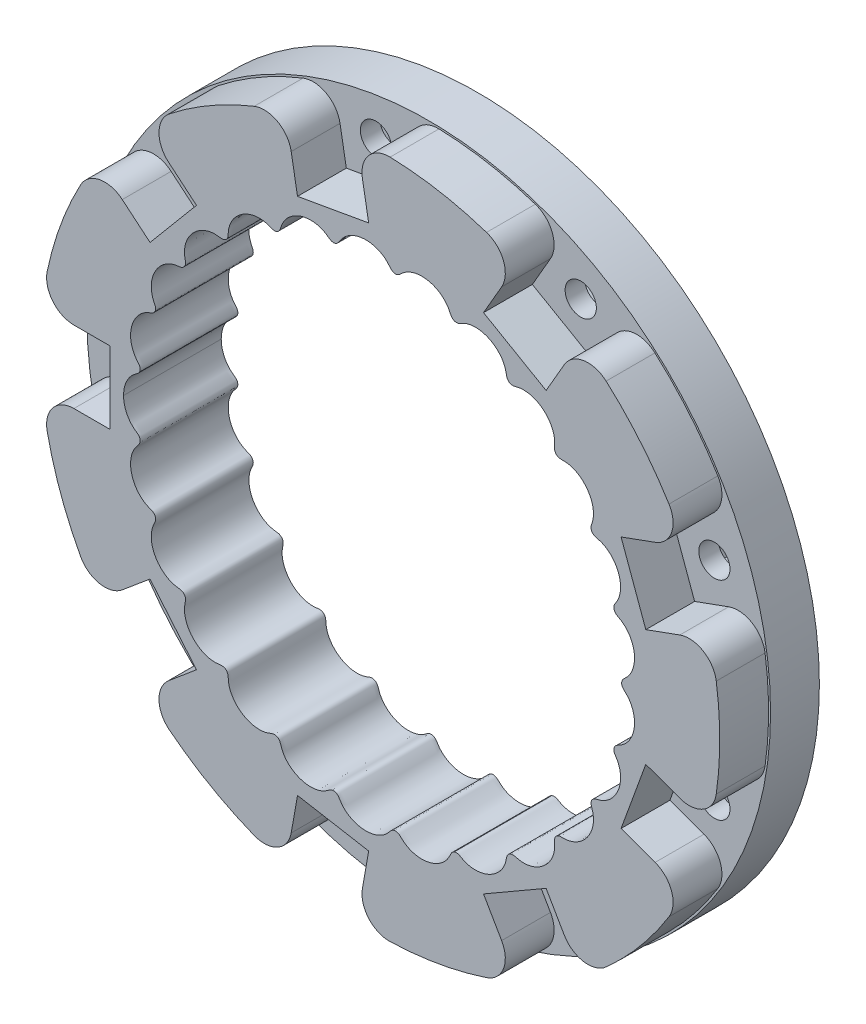
from build123d import *

# Parameters (mm, degrees)
ESQUISSE1_R             = 35
BOSS_EXTRU_1_DEPTH      = 10
ESQUISSE2_R             = 44.703039179
ENL_V_MAT_EXTRU_3_DEPTH = 5
ESQUISSE4_R             = 1.6
ENL_V_MAT_EXTRU_5_DEPTH = 50.749372006
ENL_V_MAT_EXTRU_4_DEPTH = 3


with BuildPart() as part:
    # Esquisse1 → Boss.-Extru.1 (new body)
    with BuildSketch(Plane.XY):
        Circle(ESQUISSE1_R)
        with BuildLine():
            add(Edge.make_bspline(
                [(24.75, 0), (24.75, -0.01190895), (24.750668659, -0.029768799), (24.75289752, -0.060006713), (24.758884934, -0.104774168), (24.767485304, -0.1467503), (24.785152354, -0.206071411), (24.818482478, -0.284185867), (24.880818803, -0.385919884), (24.984658612, -0.50047292), (25.114781066, -0.616600782), (25.255435339, -0.752464933), (25.419807145, -0.93333087), (25.594989864, -1.169106201), (25.768920192, -1.472936072), (25.920736133, -1.849650866), (26.023477253, -2.249860974), (26.074696747, -2.666946621), (26.073312156, -3.086313852), (26.020370658, -3.501501101), (25.917002683, -3.906273732), (25.764403676, -4.294347485), (25.566224565, -4.654785317), (25.325903213, -4.981499954), (25.081588671, -5.233067427), (24.851914535, -5.418631885), (24.667098284, -5.540217829), (24.539548747, -5.613941762), (24.410179088, -5.684594723), (24.273991814, -5.758046627), (24.120002912, -5.867762768), (23.989867, -6.050335584), (23.936355638, -6.275127193), (23.969192195, -6.495758333), (24.065351302, -6.684284012), (24.178449314, -6.851934675), (24.280144364, -7.019011908), (24.393570042, -7.235347013), (24.503436737, -7.50770452), (24.595094748, -7.84543671), (24.647032867, -8.248159789), (24.645694803, -8.661209862), (24.57595365, -9.185528563), (24.417645445, -9.696077248), (24.174741138, -10.176578568), (23.852030812, -10.610062282), (23.558837347, -10.90980476), (23.24095056, -11.157802847), (22.946586259, -11.329086722), (22.692113519, -11.440823192), (22.472657763, -11.513539342), (22.29388462, -11.561503733), (22.101259895, -11.606028638), (21.902055354, -11.681610724), (21.728453668, -11.828148656), (21.620885016, -12.038837081), (21.601595838, -12.263660858), (21.650481834, -12.469316746), (21.718254479, -12.659791435), (21.774584138, -12.84705718), (21.829677768, -13.084963879), (21.867201208, -13.376160202), (21.870688906, -13.725995236), (21.819474916, -14.128698884), (21.71419458, -14.527993453), (21.514773646, -15.017801417), (21.233133123, -15.4720736), (20.877140734, -15.876030958), (20.455657215, -16.214386724), (20.096354081, -16.430676116), (19.726170583, -16.590569736), (19.398076252, -16.68206281), (19.123633935, -16.725922166), (18.892914818, -16.74091163), (18.707848134, -16.742350192), (18.510091067, -16.737829569), (18.298399992, -16.764443666), (18.095471353, -16.866909122), (17.942147178, -17.047179332), (17.871387572, -17.261366287), (17.870202468, -17.472525416), (17.888313355, -17.673814374), (17.895669209, -17.869207586), (17.888886536, -18.113260777), (17.85168272, -18.404436203), (17.766823301, -18.743754438), (17.615819616, -19.120463832), (17.413434594, -19.48028858), (17.162321288, -19.816819375), (16.868500143, -20.122110223), (16.535786091, -20.390797243), (16.168397966, -20.617282366), (15.771042449, -20.795687849), (15.368766607, -20.914546396), (14.97017149, -20.975982916), (14.629556137, -20.981746846), (14.352921577, -20.954877105), (14.125857036, -20.911170138), (13.94640051, -20.866001244), (13.755772511, -20.812781493), (13.543469889, -20.788894817), (13.322238716, -20.84166807), (13.131407642, -20.981742865), (13.0130413, -21.173627181), (12.961818542, -21.378246364), (12.929064797, -21.57761534), (12.886990745, -21.768547341), (12.818791692, -22.002934942), (12.70930802, -22.275243379), (12.541628211, -22.582120244), (12.300626204, -22.908551746), (12.01422203, -23.205749325), (11.686582401, -23.4681837), (11.325453487, -23.689705246), (10.935854532, -23.866053147), (10.523258626, -23.992837457), (10.093696991, -24.06550579), (9.674368845, -24.079231972), (9.273085465, -24.038208914), (8.941983123, -23.957846351), (8.681067639, -23.861969077), (8.472360468, -23.762392874), (8.310008249, -23.673519219), (8.138322101, -23.574972467), (7.937182673, -23.501849574), (7.704899941, -23.502076627), (7.478095746, -23.600741865), (7.316947907, -23.77285878), (7.220831609, -23.97055906), (7.115634845, -24.203403783), (6.974300377, -24.460401189), (6.773045478, -24.737487424), (6.497851462, -25.02237666), (6.183428844, -25.270910892), (5.835740341, -25.479668636), (5.460328709, -25.645214949), (5.061542815, -25.765601822), (4.644666369, -25.83709061), (4.215744672, -25.855893135), (3.781608585, -25.818103671), (3.372294549, -25.725760832), (2.994169108, -25.584908149), (2.694109042, -25.423555897), (2.465647641, -25.264915254), (2.289085947, -25.115815571), (2.153739497, -24.989104422), (2.012318186, -24.851122457), (1.832423714, -24.733108156), (1.552983355, -24.66593755), (1.26214529, -24.754622086), (1.075414287, -24.957557798), (0.889090341, -25.194134228), (0.69672049, -25.401829912), (0.44758856, -25.61527269), (0.125683965, -25.821812182), (-0.224585626, -25.987068298), (-0.598975616, -26.109092558), (-0.990876156, -26.185347308), (-1.391941275, -26.2145582), (-1.796224618, -26.195837186), (-2.198144681, -26.128499562), (-2.591457519, -26.011923113), (-2.962803429, -25.848997421), (-3.306221845, -25.642423994), (-3.61537583, -25.39483403), (-3.850272783, -25.145621471), (-4.023133112, -24.908691884), (-4.156981332, -24.691054937), (-4.276293257, -24.506578487), (-4.456318725, -24.354528199), (-4.693068775, -24.282897531), (-4.923798246, -24.309710303), (-5.115035952, -24.406102337), (-5.273240645, -24.525178417), (-5.42301226, -24.633920894), (-5.617383402, -24.75923363), (-5.863981708, -24.887558689), (-6.182207181, -25.009385657), (-6.575059912, -25.101071531), (-6.9927825, -25.140689035), (-7.428136381, -25.123106217), (-7.851204623, -25.050059218), (-8.255644199, -24.926289526), (-8.635975215, -24.756290763), (-8.987390026, -24.544434268), (-9.305810055, -24.293211507), (-9.586131065, -24.006734367), (-9.822904508, -23.689158592), (-9.987239236, -23.388704672), (-10.094751199, -23.11580793), (-10.169610451, -22.871508954), (-10.24112571, -22.663502872), (-10.381175345, -22.473662137), (-10.594956363, -22.349311543), (-10.825624608, -22.322047042), (-11.033849204, -22.370890621), (-11.216381876, -22.447371753), (-11.388695767, -22.514940651), (-11.608352834, -22.58716666), (-11.87933894, -22.649041617), (-12.217942215, -22.68664221), (-12.621151131, -22.6763477), (-13.035301253, -22.609509201), (-13.452127793, -22.482943679), (-13.845292771, -22.304868342), (-14.20938889, -22.080540487), (-14.539531306, -21.814993299), (-14.831269767, -21.513076759), (-15.077661765, -21.181891436), (-15.275270226, -20.827454377), (-15.402577207, -20.501715906), (-15.476526159, -20.217667398), (-15.514326563, -19.976485954), (-15.531829272, -19.781749163), (-15.539202372, -19.579813227), (-15.565591069, -19.370421028), (-15.660806856, -19.1659885), (-15.83405536, -19.004717982), (-16.047591105, -18.926560558), (-16.261088064, -18.925182163), (-16.456798489, -18.954287053), (-16.640543184, -18.976331541), (-16.871307425, -18.990807395), (-17.149104778, -18.982241272), (-17.486194881, -18.933211709), (-17.873723074, -18.821638459), (-18.257615968, -18.652692803), (-18.629084532, -18.425342732), (-18.964764813, -18.15411038), (-19.260725449, -17.845401443), (-19.513475385, -17.50529118), (-19.719894943, -17.139574851), (-19.874988153, -16.756923442), (-19.976929286, -16.364037242), (-20.017953734, -16.016642642), (-20.017798024, -15.723070973), (-19.993447495, -15.480115157), (-19.96134753, -15.287225434), (-19.918054975, -15.089779832), (-19.89402871, -14.879875268), (-19.939362883, -14.658860507), (-20.070693635, -14.462043286), (-20.260249499, -14.336679591), (-20.467155514, -14.285214031), (-20.663881817, -14.2650629), (-20.847282484, -14.240161779), (-21.074211831, -14.195950386), (-21.340836688, -14.11751373), (-21.654611423, -13.985047804), (-22.001454707, -13.779432555), (-22.330360371, -13.519308084), (-22.705485211, -13.130240844), (-23.007369545, -12.684411231), (-23.229136266, -12.198075036), (-23.364819327, -11.686883469), (-23.418570267, -11.277399868), (-23.418213213, -10.871399708), (-23.370257339, -10.524800668), (-23.295965049, -10.240716159), (-23.211017087, -10.011726748), (-23.131365089, -9.833119484), (-23.040198426, -9.652618084), (-22.96715924, -9.454144986), (-22.960141523, -9.228680333), (-23.042373084, -9.007208297), (-23.198166311, -8.840665724), (-23.388940312, -8.741382585), (-23.57769294, -8.6722803), (-23.75308195, -8.599853942), (-23.966244513, -8.496298837), (-24.209343816, -8.347711506), (-24.48032477, -8.1355972), (-24.761295108, -7.846344695), (-25.008480075, -7.513349868), (-25.26655565, -7.04900195), (-25.442920247, -6.54763643), (-25.533949151, -6.025561479), (-25.536599067, -5.498854498), (-25.485486947, -5.088916426), (-25.382794666, -4.696000106), (-25.248906316, -4.372612425), (-25.105242941, -4.116427211), (-24.965170858, -3.916248887), (-24.843083512, -3.763442502), (-24.709834093, -3.611215538), (-24.591948067, -3.435387495), (-24.533798882, -3.220620895), (-24.560423715, -2.992589013), (-24.66665443, -2.797016304), (-24.822727104, -2.653701408), (-24.98966356, -2.53926073), (-25.146322188, -2.422077132), (-25.332496393, -2.263776399), (-25.502275925, -2.087254142), (-25.654526877, -1.895838833), (-25.79052351, -1.688263992), (-25.890012472, -1.511998867), (-25.978955887, -1.325507929), (-26.056614781, -1.131467198), (-26.121383307, -0.930707527), (-26.173241314, -0.729759288), (-26.207287779, -0.545661218), (-26.228372118, -0.39585777), (-26.240536879, -0.255725402), (-26.247025958, -0.16909655), (-26.249459241, -0.066739393), (-26.25, -0.022255367), (-26.25, 0)],
                knots=[0.07432085, 0.07432085, 0.07432085, 0.07432085, 0.07432085, 0.074838236, 0.075096929, 0.075355622, 0.075873009, 0.076390395, 0.077425167, 0.07845994, 0.080262761, 0.082065582, 0.083868403, 0.085671224, 0.089276866, 0.092882508, 0.096749545, 0.100616583, 0.104483621, 0.108350658, 0.112188336, 0.116026013, 0.11986369, 0.123701367, 0.12732655, 0.130951733, 0.132764324, 0.134576916, 0.135483211, 0.136389507, 0.138202099, 0.140295775, 0.142389451, 0.144458848, 0.146528245, 0.148330503, 0.150132762, 0.15193502, 0.153737278, 0.157341795, 0.160946311, 0.164812321, 0.16867833, 0.17254434, 0.180415799, 0.184421248, 0.188426697, 0.192432147, 0.195844027, 0.199255907, 0.200961848, 0.202667788, 0.204373728, 0.206079668, 0.208268892, 0.210458115, 0.21252702, 0.214595925, 0.216397713, 0.218199501, 0.220001289, 0.221803077, 0.225406654, 0.22901023, 0.232875219, 0.236740209, 0.240605199, 0.248476586, 0.252482983, 0.25648938, 0.260495777, 0.263907756, 0.267319735, 0.269025725, 0.270731714, 0.272437704, 0.274143693, 0.276335152, 0.278526612, 0.280594702, 0.282662792, 0.284464203, 0.286265613, 0.288067024, 0.289868435, 0.293471257, 0.297074079, 0.300938067, 0.304802055, 0.308666044, 0.312530032, 0.316537343, 0.320544653, 0.324551964, 0.328559274, 0.331971493, 0.335383713, 0.337089822, 0.338795932, 0.340502041, 0.342208151, 0.3444015, 0.346594848, 0.348661829, 0.35072881, 0.352529935, 0.354331061, 0.356132186, 0.357933311, 0.361535562, 0.365137813, 0.369000829, 0.372863844, 0.37672686, 0.380589876, 0.384598055, 0.388606234, 0.392614413, 0.396622592, 0.400035189, 0.403447785, 0.405154083, 0.406860381, 0.408566679, 0.410272977, 0.412467856, 0.414662735, 0.416905332, 0.41914793, 0.420947533, 0.422747136, 0.426346341, 0.429945547, 0.433544752, 0.437320979, 0.441097206, 0.444873433, 0.44864966, 0.452658654, 0.456667648, 0.460676642, 0.464685636, 0.468098738, 0.471511839, 0.473218389, 0.47492494, 0.476631491, 0.478338041, 0.480534086, 0.48273013, 0.487019518, 0.488748834, 0.49047815, 0.493936782, 0.497395414, 0.500854047, 0.504530334, 0.508206621, 0.511882908, 0.515559195, 0.519334982, 0.52311077, 0.526886557, 0.530662345, 0.534261527, 0.537860709, 0.541459892, 0.543259483, 0.545059074, 0.547300663, 0.549542252, 0.55173776, 0.553933267, 0.555639684, 0.5573461, 0.559052517, 0.560758933, 0.564171767, 0.5675846, 0.571593194, 0.575601788, 0.579610382, 0.583618976, 0.587395654, 0.591172332, 0.594949011, 0.598725689, 0.602324954, 0.605924219, 0.609523484, 0.611323117, 0.613122749, 0.615366313, 0.617609877, 0.619804036, 0.621998195, 0.623704391, 0.625410586, 0.627116782, 0.628822977, 0.632235368, 0.635647759, 0.63965551, 0.643663261, 0.647671012, 0.651678763, 0.655542261, 0.659405759, 0.663269257, 0.667132755, 0.670735268, 0.674337782, 0.676139039, 0.677940295, 0.679741552, 0.681542809, 0.683610379, 0.685677949, 0.687870397, 0.690062845, 0.691768886, 0.693474927, 0.695180968, 0.696887009, 0.700299091, 0.703711172, 0.707718031, 0.71172489, 0.715731748, 0.719738607, 0.723603093, 0.727467579, 0.731332066, 0.735196552, 0.738799727, 0.742402903, 0.744204491, 0.746006079, 0.747807667, 0.749609255, 0.751677791, 0.753746327, 0.755936711, 0.758127095, 0.75983305, 0.761539006, 0.763244962, 0.764950918, 0.76836283, 0.771774741, 0.775780668, 0.779786595, 0.783792522, 0.791663947, 0.795529445, 0.799394943, 0.803260441, 0.806864464, 0.810468487, 0.812270499, 0.81407251, 0.815874522, 0.817676533, 0.819745726, 0.821814919, 0.823998833, 0.826182748, 0.827931402, 0.829680057, 0.831428712, 0.833177366, 0.836674676, 0.840171985, 0.844093542, 0.8480151, 0.851936657, 0.859724738, 0.863591261, 0.867457784, 0.871324307, 0.874929364, 0.87853442, 0.880336948, 0.882139476, 0.883942004, 0.885744532, 0.887814048, 0.889883563, 0.891953048, 0.894022532, 0.895825669, 0.897628805, 0.899431941, 0.901235078, 0.90484135, 0.906644487, 0.908447623, 0.910381399, 0.912315175, 0.914248951, 0.916182727, 0.918116503, 0.920050278, 0.921017166, 0.921984054, 0.922950942, 0.92391783, 0.92391783, 0.92391783, 0.92391783, 0.92391783], degree=4))
            add(Edge.make_bspline(
                [(24.75, 0), (24.75, 0.01190895), (24.750668659, 0.029768799), (24.75289752, 0.060006713), (24.758884934, 0.104774168), (24.767485304, 0.1467503), (24.785152354, 0.206071411), (24.818482478, 0.284185867), (24.880818803, 0.385919884), (24.984658612, 0.50047292), (25.114781066, 0.616600782), (25.255435339, 0.752464933), (25.419807145, 0.93333087), (25.594989864, 1.169106201), (25.768920192, 1.472936072), (25.920736133, 1.849650866), (26.023477253, 2.249860974), (26.074696747, 2.666946621), (26.073312156, 3.086313852), (26.020370658, 3.501501101), (25.917002683, 3.906273732), (25.764403676, 4.294347485), (25.566224565, 4.654785317), (25.325903213, 4.981499954), (25.081588671, 5.233067427), (24.851914535, 5.418631885), (24.667098284, 5.540217829), (24.539548747, 5.613941762), (24.410179088, 5.684594723), (24.273991814, 5.758046627), (24.120002912, 5.867762768), (23.989867, 6.050335584), (23.936355638, 6.275127193), (23.969192195, 6.495758333), (24.065351302, 6.684284012), (24.178449314, 6.851934675), (24.280144364, 7.019011908), (24.393570042, 7.235347013), (24.503436737, 7.50770452), (24.595094748, 7.84543671), (24.647032867, 8.248159789), (24.645694803, 8.661209862), (24.57595365, 9.185528563), (24.417645445, 9.696077248), (24.174741138, 10.176578568), (23.852030812, 10.610062282), (23.558837347, 10.90980476), (23.24095056, 11.157802847), (22.946586259, 11.329086722), (22.692113519, 11.440823192), (22.472657763, 11.513539342), (22.29388462, 11.561503733), (22.101259895, 11.606028638), (21.902055354, 11.681610724), (21.728453668, 11.828148656), (21.620885016, 12.038837081), (21.601595838, 12.263660858), (21.650481834, 12.469316746), (21.718254479, 12.659791435), (21.774584138, 12.84705718), (21.829677768, 13.084963879), (21.867201208, 13.376160202), (21.870688906, 13.725995236), (21.819474916, 14.128698884), (21.71419458, 14.527993453), (21.514773646, 15.017801417), (21.233133123, 15.4720736), (20.877140734, 15.876030958), (20.455657215, 16.214386724), (20.096354081, 16.430676116), (19.726170583, 16.590569736), (19.398076252, 16.68206281), (19.123633935, 16.725922166), (18.892914818, 16.74091163), (18.707848134, 16.742350192), (18.510091067, 16.737829569), (18.298399992, 16.764443666), (18.095471353, 16.866909122), (17.942147178, 17.047179332), (17.871387572, 17.261366287), (17.870202468, 17.472525416), (17.888313355, 17.673814374), (17.895669209, 17.869207586), (17.888886536, 18.113260777), (17.85168272, 18.404436203), (17.766823301, 18.743754438), (17.615819616, 19.120463832), (17.413434594, 19.48028858), (17.162321288, 19.816819375), (16.868500143, 20.122110223), (16.535786091, 20.390797243), (16.168397966, 20.617282366), (15.771042449, 20.795687849), (15.368766607, 20.914546396), (14.97017149, 20.975982916), (14.629556137, 20.981746846), (14.352921577, 20.954877105), (14.125857036, 20.911170138), (13.94640051, 20.866001244), (13.755772511, 20.812781493), (13.543469889, 20.788894817), (13.322238716, 20.84166807), (13.131407642, 20.981742865), (13.0130413, 21.173627181), (12.961818542, 21.378246364), (12.929064797, 21.57761534), (12.886990745, 21.768547341), (12.818791692, 22.002934942), (12.70930802, 22.275243379), (12.541628211, 22.582120244), (12.300626204, 22.908551746), (12.01422203, 23.205749325), (11.686582401, 23.4681837), (11.325453487, 23.689705246), (10.935854532, 23.866053147), (10.523258626, 23.992837457), (10.093696991, 24.06550579), (9.674368845, 24.079231972), (9.273085465, 24.038208914), (8.941983123, 23.957846351), (8.681067639, 23.861969077), (8.472360468, 23.762392874), (8.310008249, 23.673519219), (8.138322101, 23.574972467), (7.937182673, 23.501849574), (7.704899941, 23.502076627), (7.478095746, 23.600741865), (7.316947907, 23.772858779), (7.220831609, 23.97055906), (7.115634845, 24.203403783), (6.974300377, 24.460401189), (6.773045477, 24.737487424), (6.497851462, 25.02237666), (6.183428844, 25.270910892), (5.835740341, 25.479668636), (5.460328709, 25.645214949), (5.061542815, 25.765601822), (4.644666369, 25.83709061), (4.215744672, 25.855893135), (3.781608585, 25.818103671), (3.372294549, 25.725760832), (2.994169108, 25.584908149), (2.694109042, 25.423555897), (2.465647641, 25.264915254), (2.289085947, 25.115815571), (2.153739497, 24.989104422), (2.012318186, 24.851122457), (1.832423714, 24.733108156), (1.552983354, 24.66593755), (1.26214529, 24.754622086), (1.075414287, 24.957557798), (0.889090341, 25.194134228), (0.69672049, 25.401829912), (0.44758856, 25.61527269), (0.125683965, 25.821812182), (-0.224585626, 25.987068298), (-0.598975616, 26.109092558), (-0.990876156, 26.185347308), (-1.391941275, 26.2145582), (-1.796224618, 26.195837186), (-2.198144681, 26.128499562), (-2.591457519, 26.011923113), (-2.962803429, 25.848997421), (-3.306221845, 25.642423994), (-3.61537583, 25.39483403), (-3.850272783, 25.145621471), (-4.023133112, 24.908691884), (-4.156981332, 24.691054937), (-4.276293257, 24.506578487), (-4.456318725, 24.354528199), (-4.693068775, 24.282897531), (-4.923798246, 24.309710303), (-5.115035952, 24.406102337), (-5.273240646, 24.525178417), (-5.42301226, 24.633920894), (-5.617383402, 24.75923363), (-5.863981708, 24.887558689), (-6.182207181, 25.009385657), (-6.575059912, 25.101071531), (-6.9927825, 25.140689035), (-7.428136381, 25.123106217), (-7.851204623, 25.050059218), (-8.255644199, 24.926289526), (-8.635975215, 24.756290763), (-8.987390026, 24.544434268), (-9.305810055, 24.293211507), (-9.586131065, 24.006734367), (-9.822904508, 23.689158592), (-9.987239236, 23.388704672), (-10.094751199, 23.11580793), (-10.169610451, 22.871508954), (-10.24112571, 22.663502872), (-10.381175345, 22.473662137), (-10.594956363, 22.349311543), (-10.825624608, 22.322047042), (-11.033849204, 22.370890621), (-11.216381876, 22.447371753), (-11.388695767, 22.514940651), (-11.608352834, 22.58716666), (-11.87933894, 22.649041617), (-12.217942215, 22.68664221), (-12.621151131, 22.676347699), (-13.035301253, 22.609509201), (-13.452127793, 22.482943679), (-13.845292771, 22.304868342), (-14.20938889, 22.080540487), (-14.539531306, 21.814993299), (-14.831269767, 21.513076759), (-15.077661765, 21.181891436), (-15.275270226, 20.827454377), (-15.402577207, 20.501715906), (-15.476526159, 20.217667398), (-15.514326563, 19.976485954), (-15.531829272, 19.781749163), (-15.539202372, 19.579813227), (-15.565591069, 19.370421028), (-15.660806856, 19.1659885), (-15.83405536, 19.004717982), (-16.047591105, 18.926560558), (-16.261088064, 18.925182163), (-16.456798489, 18.954287053), (-16.640543184, 18.976331541), (-16.871307425, 18.990807395), (-17.149104778, 18.982241272), (-17.486194881, 18.933211709), (-17.873723074, 18.821638459), (-18.257615968, 18.652692802), (-18.629084532, 18.425342732), (-18.964764813, 18.15411038), (-19.260725449, 17.845401443), (-19.513475385, 17.50529118), (-19.719894943, 17.139574851), (-19.874988153, 16.756923442), (-19.976929286, 16.364037242), (-20.017953734, 16.016642642), (-20.017798024, 15.723070973), (-19.993447495, 15.480115157), (-19.96134753, 15.287225434), (-19.918054975, 15.089779832), (-19.89402871, 14.879875268), (-19.939362883, 14.658860507), (-20.070693635, 14.462043286), (-20.260249499, 14.336679591), (-20.467155514, 14.285214031), (-20.663881817, 14.2650629), (-20.847282484, 14.240161779), (-21.074211831, 14.195950386), (-21.340836688, 14.11751373), (-21.654611423, 13.985047804), (-22.001454707, 13.779432555), (-22.330360371, 13.519308084), (-22.705485211, 13.130240844), (-23.007369545, 12.684411231), (-23.229136266, 12.198075036), (-23.364819327, 11.686883469), (-23.418570267, 11.277399868), (-23.418213213, 10.871399708), (-23.370257339, 10.524800667), (-23.295965049, 10.240716159), (-23.211017087, 10.011726748), (-23.131365089, 9.833119484), (-23.040198426, 9.652618084), (-22.96715924, 9.454144986), (-22.960141523, 9.228680333), (-23.042373084, 9.007208297), (-23.198166311, 8.840665724), (-23.388940312, 8.741382585), (-23.57769294, 8.6722803), (-23.75308195, 8.599853942), (-23.966244513, 8.496298837), (-24.209343816, 8.347711506), (-24.48032477, 8.1355972), (-24.761295108, 7.846344695), (-25.008480075, 7.513349868), (-25.26655565, 7.04900195), (-25.442920247, 6.54763643), (-25.533949151, 6.025561479), (-25.536599067, 5.498854498), (-25.485486947, 5.088916426), (-25.382794666, 4.696000106), (-25.248906316, 4.372612425), (-25.105242941, 4.116427211), (-24.965170858, 3.916248887), (-24.843083512, 3.763442502), (-24.709834093, 3.611215538), (-24.591948067, 3.435387495), (-24.533798882, 3.220620895), (-24.560423715, 2.992589013), (-24.66665443, 2.797016303), (-24.822727104, 2.653701408), (-24.98966356, 2.53926073), (-25.146322188, 2.422077132), (-25.332496393, 2.263776399), (-25.502275925, 2.087254142), (-25.654526877, 1.895838833), (-25.79052351, 1.688263992), (-25.890012472, 1.511998867), (-25.978955887, 1.325507929), (-26.056614781, 1.131467198), (-26.121383307, 0.930707527), (-26.173241314, 0.729759288), (-26.207287779, 0.545661218), (-26.228372118, 0.39585777), (-26.240536879, 0.255725402), (-26.247025958, 0.16909655), (-26.249459241, 0.066739393), (-26.25, 0.022255367), (-26.25, 0)],
                knots=[0.07432085, 0.07432085, 0.07432085, 0.07432085, 0.07432085, 0.074838236, 0.075096929, 0.075355622, 0.075873009, 0.076390395, 0.077425167, 0.07845994, 0.080262761, 0.082065582, 0.083868403, 0.085671224, 0.089276866, 0.092882508, 0.096749545, 0.100616583, 0.104483621, 0.108350658, 0.112188336, 0.116026013, 0.11986369, 0.123701367, 0.12732655, 0.130951733, 0.132764324, 0.134576916, 0.135483211, 0.136389507, 0.138202099, 0.140295775, 0.142389451, 0.144458848, 0.146528245, 0.148330503, 0.150132762, 0.15193502, 0.153737278, 0.157341795, 0.160946311, 0.164812321, 0.16867833, 0.17254434, 0.180415799, 0.184421248, 0.188426697, 0.192432147, 0.195844027, 0.199255907, 0.200961848, 0.202667788, 0.204373728, 0.206079668, 0.208268892, 0.210458115, 0.21252702, 0.214595925, 0.216397713, 0.218199501, 0.220001289, 0.221803077, 0.225406654, 0.22901023, 0.232875219, 0.236740209, 0.240605199, 0.248476586, 0.252482983, 0.25648938, 0.260495777, 0.263907756, 0.267319735, 0.269025725, 0.270731714, 0.272437704, 0.274143693, 0.276335152, 0.278526612, 0.280594702, 0.282662792, 0.284464203, 0.286265613, 0.288067024, 0.289868435, 0.293471257, 0.297074079, 0.300938067, 0.304802055, 0.308666044, 0.312530032, 0.316537343, 0.320544653, 0.324551964, 0.328559274, 0.331971493, 0.335383713, 0.337089822, 0.338795932, 0.340502041, 0.342208151, 0.3444015, 0.346594848, 0.348661829, 0.35072881, 0.352529935, 0.354331061, 0.356132186, 0.357933311, 0.361535562, 0.365137813, 0.369000829, 0.372863844, 0.37672686, 0.380589876, 0.384598055, 0.388606234, 0.392614413, 0.396622592, 0.400035189, 0.403447785, 0.405154083, 0.406860381, 0.408566679, 0.410272977, 0.412467856, 0.414662735, 0.416905332, 0.41914793, 0.420947533, 0.422747136, 0.426346341, 0.429945547, 0.433544752, 0.437320979, 0.441097206, 0.444873433, 0.44864966, 0.452658654, 0.456667648, 0.460676642, 0.464685636, 0.468098738, 0.471511839, 0.473218389, 0.47492494, 0.476631491, 0.478338041, 0.480534086, 0.48273013, 0.487019518, 0.488748834, 0.49047815, 0.493936782, 0.497395414, 0.500854047, 0.504530334, 0.508206621, 0.511882908, 0.515559195, 0.519334982, 0.52311077, 0.526886557, 0.530662345, 0.534261527, 0.537860709, 0.541459892, 0.543259483, 0.545059074, 0.547300663, 0.549542252, 0.55173776, 0.553933267, 0.555639684, 0.5573461, 0.559052517, 0.560758933, 0.564171767, 0.5675846, 0.571593194, 0.575601788, 0.579610382, 0.583618976, 0.587395654, 0.591172332, 0.594949011, 0.598725689, 0.602324954, 0.605924219, 0.609523484, 0.611323117, 0.613122749, 0.615366313, 0.617609877, 0.619804036, 0.621998195, 0.623704391, 0.625410586, 0.627116782, 0.628822977, 0.632235368, 0.635647759, 0.63965551, 0.643663261, 0.647671012, 0.651678763, 0.655542261, 0.659405759, 0.663269257, 0.667132755, 0.670735268, 0.674337782, 0.676139039, 0.677940295, 0.679741552, 0.681542809, 0.683610379, 0.685677949, 0.687870397, 0.690062845, 0.691768886, 0.693474927, 0.695180968, 0.696887009, 0.700299091, 0.703711172, 0.707718031, 0.71172489, 0.715731748, 0.719738607, 0.723603093, 0.727467579, 0.731332066, 0.735196552, 0.738799727, 0.742402903, 0.744204491, 0.746006079, 0.747807667, 0.749609255, 0.751677791, 0.753746327, 0.755936711, 0.758127095, 0.75983305, 0.761539006, 0.763244962, 0.764950918, 0.76836283, 0.771774741, 0.775780668, 0.779786595, 0.783792522, 0.791663947, 0.795529445, 0.799394943, 0.803260441, 0.806864464, 0.810468487, 0.812270499, 0.81407251, 0.815874522, 0.817676533, 0.819745726, 0.821814919, 0.823998833, 0.826182748, 0.827931402, 0.829680057, 0.831428712, 0.833177366, 0.836674676, 0.840171985, 0.844093542, 0.8480151, 0.851936657, 0.859724738, 0.863591261, 0.867457784, 0.871324307, 0.874929364, 0.87853442, 0.880336948, 0.882139476, 0.883942004, 0.885744532, 0.887814048, 0.889883563, 0.891953048, 0.894022532, 0.895825669, 0.897628805, 0.899431941, 0.901235078, 0.90484135, 0.906644487, 0.908447623, 0.910381399, 0.912315175, 0.914248951, 0.916182727, 0.918116503, 0.920050278, 0.921017166, 0.921984054, 0.922950942, 0.92391783, 0.92391783, 0.92391783, 0.92391783, 0.92391783], degree=4))
        make_face(mode=Mode.SUBTRACT)
    extrude(amount=BOSS_EXTRU_1_DEPTH)

    # Esquisse2 → Enlèv. mat.-Extru.3 (cut)
    with BuildSketch(Plane.XY.offset(10)):
        Circle(ESQUISSE2_R)
        with BuildLine():
            Line((-31.332890068, -3.7), (-27.624560299, -3.7))
            Line((-27.624560299, -3.7), (-27.624560299, 3.7))
            Line((-27.624560299, 3.7), (-31.332890068, 3.7))
            ThreePointArc((-31.332890068, 3.7), (-33.504582956, 4.732586636), (-34.074517949, 7.06875))
            ThreePointArc((-34.074517949, 7.06875), (-32.701303203, 11.902300988), (-30.646300043, 16.487701286))
            ThreePointArc((-30.646300043, 16.487701286), (-28.708047644, 17.910959098), (-26.380700479, 17.306029072))
            Line((-26.380700479, 17.306029072), (-23.539955066, 14.922360644))
            Line((-23.539955066, 14.922360644), (-18.783326755, 20.591089523))
            Line((-18.783326755, 20.591089523), (-21.624072167, 22.974757951))
            ThreePointArc((-21.624072167, 22.974757951), (-22.623951541, 25.161702486), (-21.558890211, 27.317654601))
            ThreePointArc((-21.558890211, 27.317654601), (-17.4, 30.137684052), (-12.878337751, 32.3293739))
            ThreePointArc((-12.878337751, 32.3293739), (-10.478697784, 32.173768011), (-9.084687947, 30.214374806))
            Line((-9.084687947, 30.214374806), (-8.440743241, 26.562382898))
            Line((-8.440743241, 26.562382898), (-1.153165869, 27.847379413))
            Line((-1.153165869, 27.847379413), (-1.797110575, 31.49937132))
            ThreePointArc((-1.797110575, 31.49937132), (-1.157321763, 33.817378101), (1.044381857, 34.784325012))
            ThreePointArc((1.044381857, 34.784325012), (6.042956583, 34.271309805), (10.915541901, 33.043773165))
            ThreePointArc((10.915541901, 33.043773165), (12.653751226, 31.382113301), (12.46215104, 28.985078773))
            Line((12.46215104, 28.985078773), (10.607986155, 25.773570987))
            Line((10.607986155, 25.773570987), (17.016574143, 22.073570987))
            Line((17.016574143, 22.073570987), (18.870739028, 25.285078773))
            ThreePointArc((18.870739028, 25.285078773), (20.85083173, 26.649526665), (23.158976047, 25.975023165))
            ThreePointArc((23.158976047, 25.975023165), (26.658346621, 22.369008817), (29.601918185, 18.296623726))
            ThreePointArc((29.601918185, 18.296623726), (29.865369407, 15.906419004), (28.177811054, 14.193342249))
            Line((28.177811054, 14.193342249), (24.693120935, 12.92501877))
            Line((24.693120935, 12.92501877), (27.224069995, 5.971293376))
            Line((27.224069995, 5.971293376), (30.708760115, 7.239616855))
            ThreePointArc((30.708760115, 7.239616855), (33.102649326, 7.012065526), (34.437227961, 5.011719299))
            ThreePointArc((34.437227961, 5.011719299), (34.8, 0), (34.437227961, -5.011719299))
            ThreePointArc((34.437227961, -5.011719299), (33.102649326, -7.012065526), (30.708760115, -7.239616855))
            Line((30.708760115, -7.239616855), (27.224069995, -5.971293376))
            Line((27.224069995, -5.971293376), (24.693120935, -12.92501877))
            Line((24.693120935, -12.92501877), (28.177811054, -14.193342249))
            ThreePointArc((28.177811054, -14.193342249), (29.865369407, -15.906419004), (29.601918185, -18.296623726))
            ThreePointArc((29.601918185, -18.296623726), (26.658346621, -22.369008817), (23.158976047, -25.975023165))
            ThreePointArc((23.158976047, -25.975023165), (20.85083173, -26.649526665), (18.870739028, -25.285078773))
            Line((18.870739028, -25.285078773), (17.016574143, -22.073570987))
            Line((17.016574143, -22.073570987), (10.607986155, -25.773570987))
            Line((10.607986155, -25.773570987), (12.46215104, -28.985078773))
            ThreePointArc((12.46215104, -28.985078773), (12.653751226, -31.382113301), (10.915541901, -33.043773165))
            ThreePointArc((10.915541901, -33.043773165), (6.042956583, -34.271309805), (1.044381857, -34.784325012))
            ThreePointArc((1.044381857, -34.784325012), (-1.157321763, -33.817378101), (-1.797110575, -31.49937132))
            Line((-1.797110575, -31.49937132), (-1.153165869, -27.847379413))
            Line((-1.153165869, -27.847379413), (-8.440743241, -26.562382898))
            Line((-8.440743241, -26.562382898), (-9.084687947, -30.214374806))
            ThreePointArc((-9.084687947, -30.214374806), (-10.478697784, -32.173768011), (-12.878337751, -32.3293739))
            ThreePointArc((-12.878337751, -32.3293739), (-17.4, -30.137684052), (-21.558890211, -27.317654601))
            ThreePointArc((-21.558890211, -27.317654601), (-22.623951541, -25.161702486), (-21.624072167, -22.974757951))
            Line((-21.624072167, -22.974757951), (-18.783326755, -20.591089523))
            Line((-18.783326755, -20.591089523), (-23.539955066, -14.922360644))
            Line((-23.539955066, -14.922360644), (-26.380700479, -17.306029072))
            ThreePointArc((-26.380700479, -17.306029072), (-28.708047644, -17.910959098), (-30.646300043, -16.487701286))
            ThreePointArc((-30.646300043, -16.487701286), (-32.701303203, -11.902300988), (-34.074517949, -7.06875))
            ThreePointArc((-34.074517949, -7.06875), (-33.504582956, -4.732586636), (-31.332890068, -3.7))
        make_face(mode=Mode.SUBTRACT)
    extrude(amount=-ENL_V_MAT_EXTRU_3_DEPTH, mode=Mode.SUBTRACT)

    # Esquisse4 → Enlèv. mat.-Extru.5 (cut, through all)
    with BuildSketch(Plane.XY.offset(5)):
        with Locations((-31.124560299, 0)):
            Circle(ESQUISSE4_R)
        with Locations((-23.842796461, 20.006481717)):
            Circle(ESQUISSE4_R)
        with Locations((-5.404723177, 30.651708291)):
            Circle(ESQUISSE4_R)
        with Locations((15.562280149, 26.9546599)):
            Circle(ESQUISSE4_R)
        with Locations((29.247519638, 10.645226574)):
            Circle(ESQUISSE4_R)
        with Locations((29.247519638, -10.645226574)):
            Circle(ESQUISSE4_R)
        with Locations((15.562280149, -26.9546599)):
            Circle(ESQUISSE4_R)
        with Locations((-5.404723177, -30.651708291)):
            Circle(ESQUISSE4_R)
        with Locations((-23.842796461, -20.006481717)):
            Circle(ESQUISSE4_R)
    extrude(amount=-ENL_V_MAT_EXTRU_5_DEPTH, mode=Mode.SUBTRACT)

    # Esquisse3 → Enlèv. mat.-Extru.4 (cut)
    with BuildSketch(Plane(origin=(0, 0, 0), x_dir=(-1, 0, 0), z_dir=(0, 0, -1))):
        Polygon((21.988211299, -22.218686241), (24.831106405, -22.719965351), (26.686674403, -20.508585524), (25.699347294, -17.795926586), (22.856452187, -17.294647476), (21.00088419, -19.506027303), align=None)
        Polygon((31.125843299, -2.886751346), (33.625843299, -1.443375673), (33.625843299, 1.443375673), (31.125843299, 2.886751346), (28.625843299, 1.443375673), (28.625843299, -1.443375673), align=None)
        Polygon((2.562050861, -31.15425091), (4.417618858, -33.365630737), (7.260513965, -32.864351627), (8.247841074, -30.151692689), (6.392273076, -27.940312862), (3.54937797, -28.441591972), align=None)
        Polygon((-18.062921649, -25.512395338), (-18.062921649, -28.399146684), (-15.562921649, -29.842522357), (-13.062921649, -28.399146684), (-13.062921649, -25.512395338), (-15.562921649, -24.069019665), align=None)
        Polygon((-30.236052373, -7.933006448), (-32.09162037, -10.144386276), (-31.104293261, -12.857045213), (-28.261398154, -13.358324324), (-26.405830157, -11.146944497), (-27.393157266, -8.434285559), align=None)
        Polygon((-28.261398154, 13.358324324), (-31.104293261, 12.857045213), (-32.09162037, 10.144386276), (-30.236052373, 7.933006448), (-27.393157266, 8.434285559), (-26.405830157, 11.146944497), align=None)
        Polygon((-13.062921649, 28.399146684), (-15.562921649, 29.842522357), (-18.062921649, 28.399146684), (-18.062921649, 25.512395338), (-15.562921649, 24.069019665), (-13.062921649, 25.512395338), align=None)
        Polygon((8.247841074, 30.151692689), (7.260513965, 32.864351627), (4.417618858, 33.365630737), (2.562050861, 31.15425091), (3.54937797, 28.441591972), (6.392273076, 27.940312862), align=None)
        Polygon((25.699347294, 17.795926586), (26.686674403, 20.508585524), (24.831106405, 22.719965351), (21.988211299, 22.218686241), (21.00088419, 19.506027303), (22.856452187, 17.294647476), align=None)
    extrude(amount=-ENL_V_MAT_EXTRU_4_DEPTH, mode=Mode.SUBTRACT)


solid = part.part
